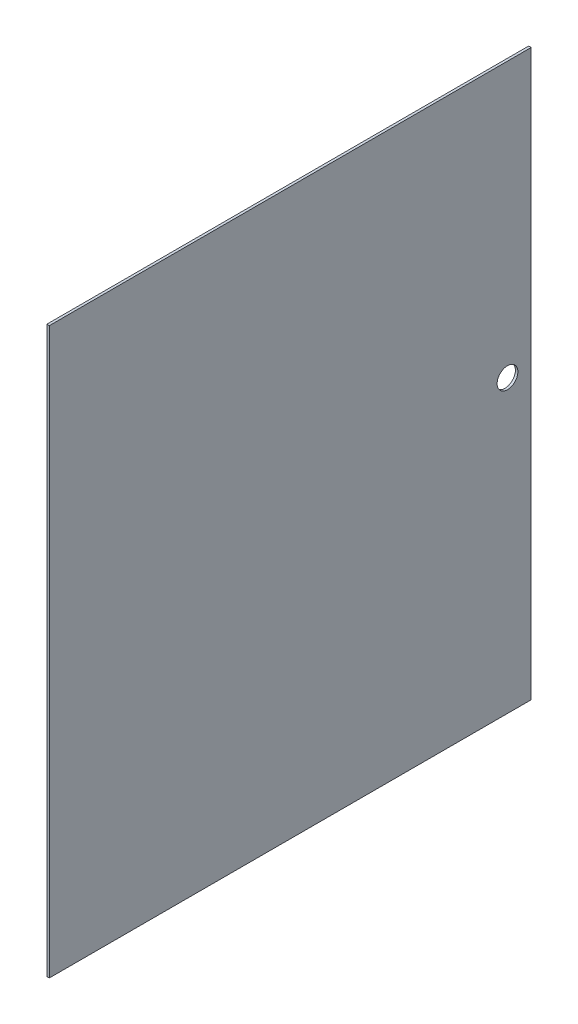
from build123d import *

# Parameters (mm, degrees)
CROQUIS1_W              = 580
CROQUIS1_H              = 680
SALIENTE_EXTRUIR1_DEPTH = 3
CORTAR_EXTRUIR1_REACH   = 448.888
CROQUIS2_R              = 12.5


with BuildPart() as part:
    # Croquis1 → Saliente-Extruir1 (new body)
    with BuildSketch(Plane(origin=(0, 0, 0), x_dir=(0, 0, -1), z_dir=(1, 0, 0))):
        Rectangle(CROQUIS1_W, CROQUIS1_H)
    extrude(amount=SALIENTE_EXTRUIR1_DEPTH)

    # Croquis2 → Cortar-Extruir1 (cut, up to next)
    with BuildSketch(Plane.ZY, mode=Mode.PRIVATE) as cortar_extruir1_sk1:
        with Locations((-261.5, 10)):
            Circle(CROQUIS2_R)
    cortar_extruir1_tool1 = extrude(cortar_extruir1_sk1.sketch, amount=-CORTAR_EXTRUIR1_REACH, mode=Mode.PRIVATE) & part.part
    add(cortar_extruir1_tool1.solids().sort_by_distance((0, 10, -261.5))[0], mode=Mode.SUBTRACT)


solid = part.part
